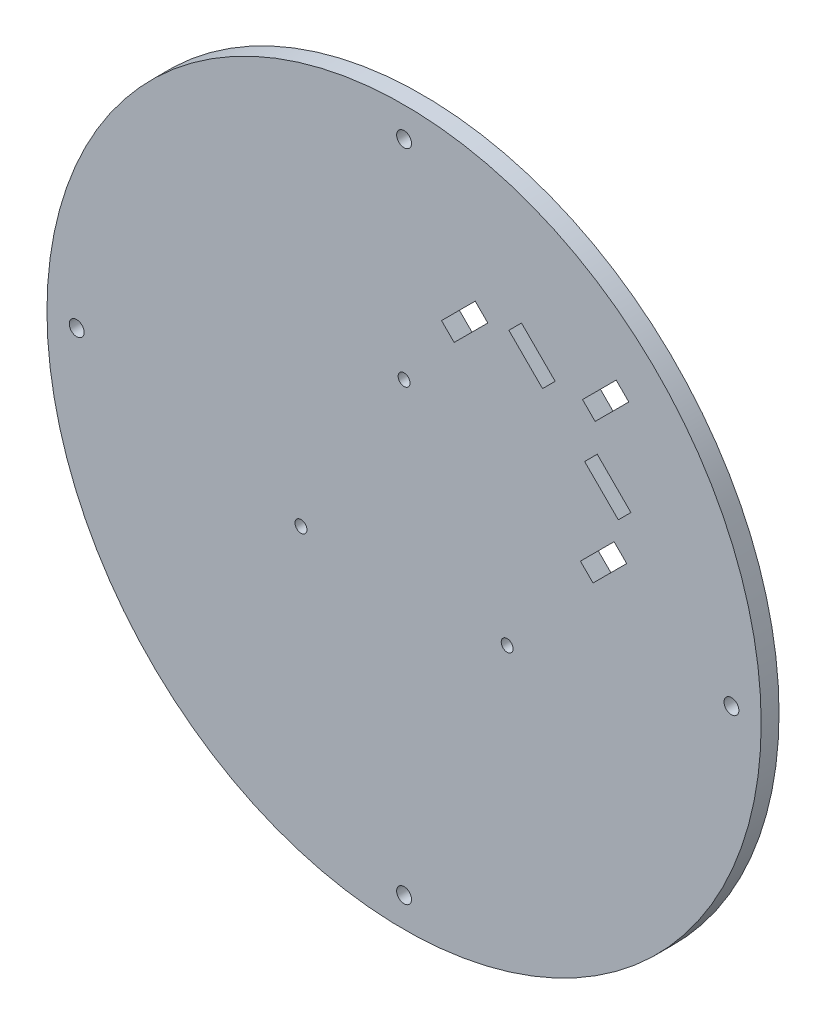
from build123d import *

# Parameters (mm, degrees)
SKETCH_1_R      = 60
SKETCH_1_R_2    = 1.25
SKETCH_1_R_3    = 1
EXTRUDE_1_DEPTH = 3


with BuildPart() as part:
    # 草图1 → 凸台-拉伸1 (new body)
    with BuildSketch(Plane.XY):
        Circle(SKETCH_1_R)
        with Locations((55, 0)):
            Circle(SKETCH_1_R_2, mode=Mode.SUBTRACT)
        with Locations((0, 55)):
            Circle(SKETCH_1_R_2, mode=Mode.SUBTRACT)
        with Locations((0, -55)):
            Circle(SKETCH_1_R_2, mode=Mode.SUBTRACT)
        with Locations((-55, 0)):
            Circle(SKETCH_1_R_2, mode=Mode.SUBTRACT)
        with Locations((0, 20)):
            Circle(SKETCH_1_R_3, mode=Mode.SUBTRACT)
        with Locations((17.320508076, -10)):
            Circle(SKETCH_1_R_3, mode=Mode.SUBTRACT)
        with Locations((-17.320508076, -10)):
            Circle(SKETCH_1_R_3, mode=Mode.SUBTRACT)
        Polygon((35.991735162, 17.606958852), (30.334880913, 23.263813101), (32.456201256, 25.385133445), (38.113055506, 19.728279195), align=None, mode=Mode.SUBTRACT)
        Polygon((23.263813101, 30.334880913), (25.385133445, 32.456201256), (19.728279195, 38.113055506), (17.606958852, 35.991735162), align=None, mode=Mode.SUBTRACT)
        Polygon((11.950104602, 37.405948725), (14.071424946, 35.284628381), (8.414570696, 29.627774132), (6.293250353, 31.749094475), align=None, mode=Mode.SUBTRACT)
        Polygon((31.749094475, 6.293250353), (37.405948725, 11.950104602), (35.284628381, 14.071424946), (29.627774132, 8.414570696), align=None, mode=Mode.SUBTRACT)
        Polygon((29.981327522, 32.102647866), (32.102647866, 29.981327522), (37.759502115, 35.638181772), (35.638181772, 37.759502115), align=None, mode=Mode.SUBTRACT)
    extrude(amount=EXTRUDE_1_DEPTH)


solid = part.part
